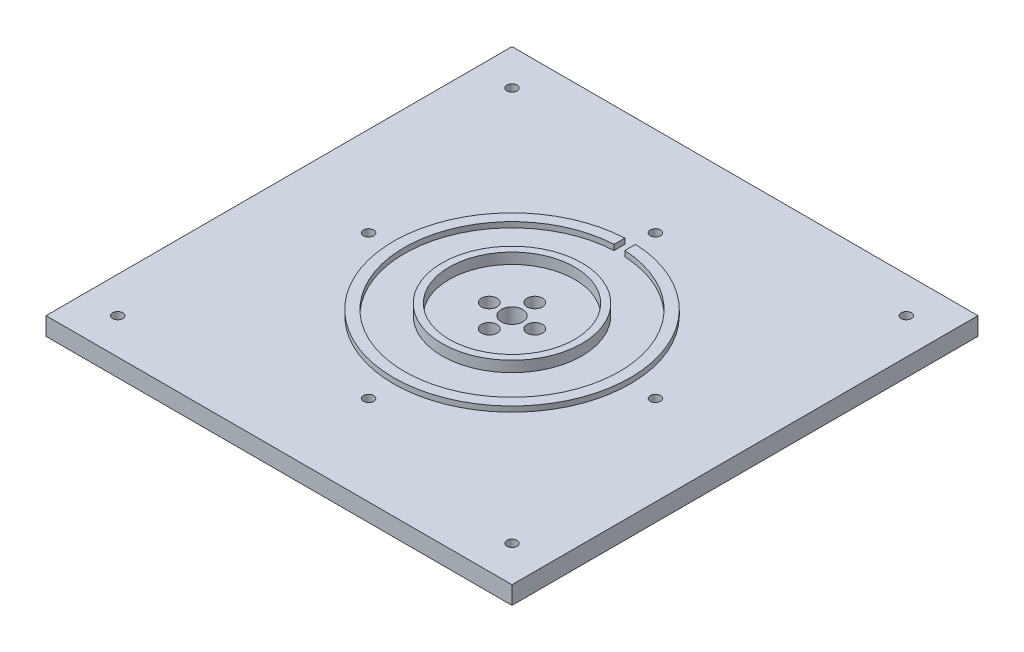
from build123d import *

# Parameters (mm, degrees)
SKETCH1_W           = 130
SKETCH1_H           = 130
SKETCH1_R           = 31
SKETCH1_R_2         = 26
SKETCH1_R_3         = 24
BOSS_EXTRUDE2_DEPTH = 5
SKETCH2_R           = 33
SKETCH2_R_2         = 30
BOSS_EXTRUDE3_DEPTH = 1.5
SKETCH3_R           = 2.15
SKETCH3_R_2         = 3
CUT_EXTRUDE1_DEPTH  = 5
SKETCH5_R           = 1.42
CUT_EXTRUDE3_DEPTH  = 10
SKETCH6_R           = 19.5
SKETCH6_R_2         = 17.5
BOSS_EXTRUDE4_DEPTH = 3
SKETCH7_W           = 3
SKETCH7_H           = 7.819809603
CUT_EXTRUDE5_DEPTH  = 1.5


with BuildPart() as part:
    # Sketch1 → Boss-Extrude2 (new body)
    # profile 1 of 4: a face of its own
    with BuildSketch(Plane(origin=(0, 0, 0), x_dir=(1, 0, 0), z_dir=(0, 1, 0))):
        Rectangle(SKETCH1_W, SKETCH1_H)
        Circle(SKETCH1_R, mode=Mode.SUBTRACT)
    # profile 2 of 4: a face of its own
    with BuildSketch(Plane(origin=(0, 0, 0), x_dir=(1, 0, 0), z_dir=(0, 1, 0))):
        Circle(SKETCH1_R)
        Circle(SKETCH1_R_2, mode=Mode.SUBTRACT)
    # profile 3 of 4: a face of its own
    with BuildSketch(Plane(origin=(0, 0, 0), x_dir=(1, 0, 0), z_dir=(0, 1, 0))):
        Circle(SKETCH1_R_2)
        Circle(SKETCH1_R_3, mode=Mode.SUBTRACT)
    # profile 4 of 4: a face of its own
    with BuildSketch(Plane(origin=(0, 0, 0), x_dir=(1, 0, 0), z_dir=(0, 1, 0))):
        Circle(SKETCH1_R_3)
    extrude(amount=BOSS_EXTRUDE2_DEPTH)

    # Sketch2 → Boss-Extrude3 (add)
    with BuildSketch(Plane(origin=(0, 5, 0), x_dir=(1, 0, 0), z_dir=(0, 1, 0))):
        with Locations(Location((0, 0, 0), (0, 0, 270))):
            Circle(SKETCH2_R)
        with Locations(Location((0, 0, 0), (0, 0, 270))):
            Circle(SKETCH2_R_2, mode=Mode.SUBTRACT)
    extrude(amount=BOSS_EXTRUDE3_DEPTH)

    # Sketch3 → Cut-Extrude1 (cut)
    with BuildSketch(Plane(origin=(0, 5, 0), x_dir=(1, 0, 0), z_dir=(0, 1, 0))):
        with Locations(Location((0, 6.35, 0), (0, 0, 270))):
            Circle(SKETCH3_R)
        with Locations(Location((6.35, 0, 0), (0, 0, 270))):
            Circle(SKETCH3_R)
        with Locations(Location((0, -6.35, 0), (0, 0, 270))):
            Circle(SKETCH3_R)
        with Locations(Location((-6.35, 0, 0), (0, 0, 270))):
            Circle(SKETCH3_R)
        with Locations(Location((0, 0, 0), (0, 0, 270))):
            Circle(SKETCH3_R_2)
    extrude(amount=-CUT_EXTRUDE1_DEPTH, mode=Mode.SUBTRACT)

    # Sketch5 → Cut-Extrude3 (cut)
    with BuildSketch(Plane(origin=(0, 5, 0), x_dir=(1, 0, 0), z_dir=(0, 1, 0))):
        with Locations(Location((-55, 55, 0), (0, 0, 270))):
            Circle(SKETCH5_R)
        with Locations(Location((-55, -55, 0), (0, 0, 270))):
            Circle(SKETCH5_R)
        with Locations(Location((55, -55, 0), (0, 0, 270))):
            Circle(SKETCH5_R)
        with Locations(Location((55, 55, 0), (0, 0, 270))):
            Circle(SKETCH5_R)
        with Locations(Location((0, 40, 0), (0, 0, 270))):
            Circle(SKETCH5_R)
        with Locations(Location((-40, 0, 0), (0, 0, 270))):
            Circle(SKETCH5_R)
        with Locations(Location((40, 0, 0), (0, 0, 270))):
            Circle(SKETCH5_R)
        with Locations(Location((0, -40, 0), (0, 0, 270))):
            Circle(SKETCH5_R)
    extrude(amount=-CUT_EXTRUDE3_DEPTH, mode=Mode.SUBTRACT)

    # Sketch6 → Boss-Extrude4 (add)
    with BuildSketch(Plane(origin=(0, 5, 0), x_dir=(1, 0, 0), z_dir=(0, 1, 0))):
        with Locations(Location((0, 0, 0), (0, 0, 270))):
            Circle(SKETCH6_R)
        with Locations(Location((0, 0, 0), (0, 0, 270))):
            Circle(SKETCH6_R_2, mode=Mode.SUBTRACT)
    extrude(amount=BOSS_EXTRUDE4_DEPTH)

    # Sketch7 → Cut-Extrude5 (cut)
    with BuildSketch(Plane(origin=(0, 6.5, 0), x_dir=(1, 0, 0), z_dir=(0, 1, 0))):
        with Locations((0, 31.405364374)):
            Rectangle(SKETCH7_W, SKETCH7_H)
    extrude(amount=-CUT_EXTRUDE5_DEPTH, mode=Mode.SUBTRACT)


solid = part.part
